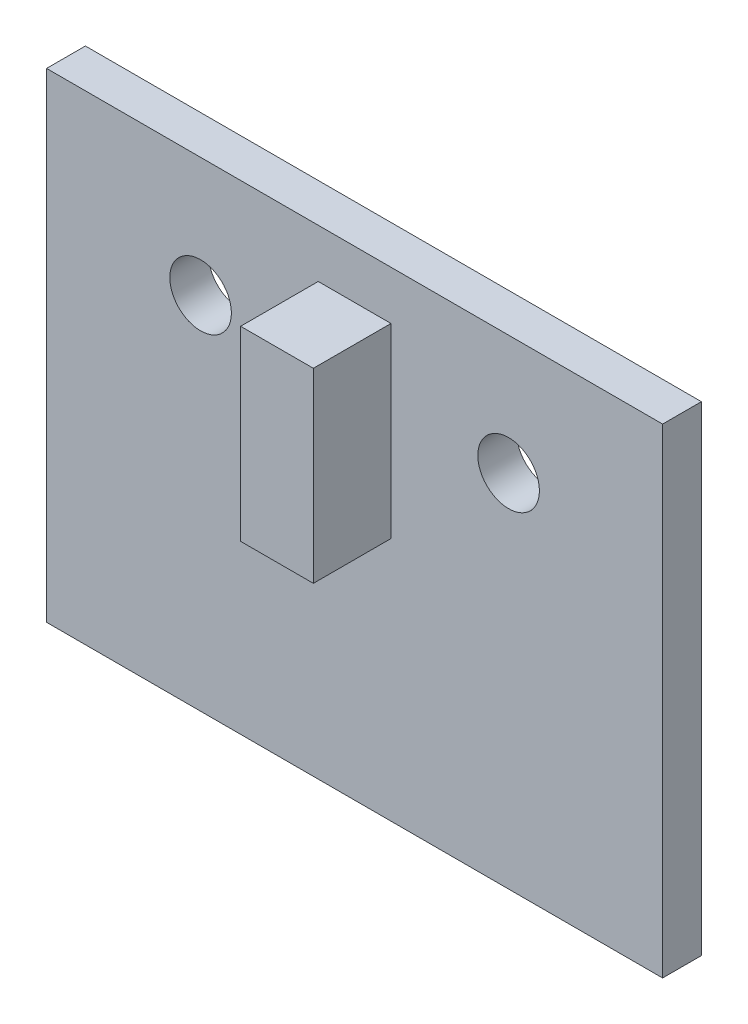
from build123d import *

# Parameters (mm, degrees)
SKETCH1_W           = 63.5
SKETCH1_H           = 49.45
SKETCH1_W_2         = 7.5
SKETCH1_H_2         = 19.2
SKETCH1_R           = 3.175
BOSS_EXTRUDE1_DEPTH = 4
BOSS_EXTRUDE2_DEPTH = 12


with BuildPart() as part:
    # Sketch1 → Boss-Extrude1 (new body)
    with BuildSketch(Plane.XY):
        with Locations((0, 20.59)):
            Rectangle(SKETCH1_W, SKETCH1_H)
        with Locations((0, 30.695)):
            Rectangle(SKETCH1_W_2, SKETCH1_H_2, mode=Mode.SUBTRACT)
        with Locations((-15.875, 33)):
            Circle(SKETCH1_R, mode=Mode.SUBTRACT)
        with Locations((15.875, 33)):
            Circle(SKETCH1_R, mode=Mode.SUBTRACT)
    extrude(amount=BOSS_EXTRUDE1_DEPTH)


with BuildPart() as body_2:
    # Sketch1<3> → Boss-Extrude2 (new body)
    with BuildSketch(Plane.XY):
        Polygon((0, 40.295), (-3.75, 40.295), (-3.75, 21.095), (0, 21.095), (3.75, 21.095), (3.75, 40.295), align=None)
    extrude(amount=BOSS_EXTRUDE2_DEPTH)


solid = Compound([part.part, body_2.part])
